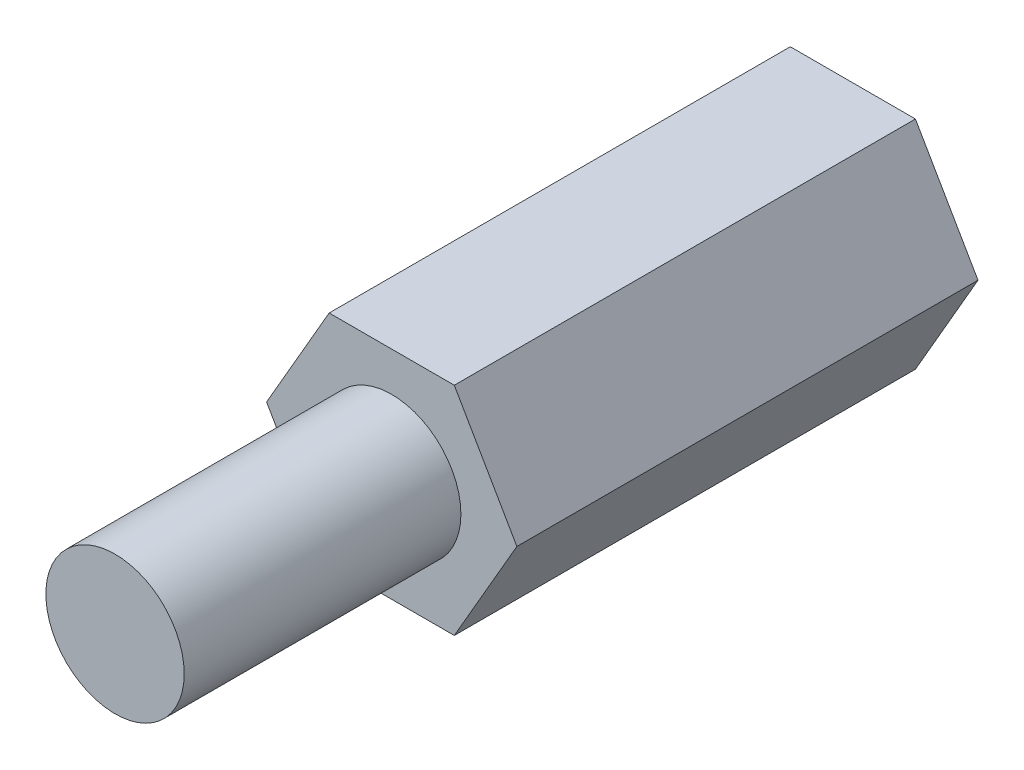
from build123d import *

# Parameters (mm, degrees)
EXTRUDE_1_DEPTH     = 10
SKETCH_2_R          = 1.5
EXTRUDE_2_DEPTH     = 6
SKETCH_3_R          = 1.5
CUT_EXTRUDE_1_DEPTH = 6


with BuildPart() as part:
    # 草图1 → 凸台-拉伸1 (new body)
    with BuildSketch(Plane.XY):
        Polygon((2.713546265, 0), (1.356773133, 2.35), (-1.356773133, 2.35), (-2.713546265, 0), (-1.356773133, -2.35), (1.356773133, -2.35), align=None)
    extrude(amount=EXTRUDE_1_DEPTH)

    # 草图2 → 凸台-拉伸2 (add)
    with BuildSketch(Plane.XY.offset(10)):
        Circle(SKETCH_2_R)
    extrude(amount=EXTRUDE_2_DEPTH)

    # 草图3 → 切除-拉伸1 (cut)
    with BuildSketch(Plane(origin=(0, 0, 0), x_dir=(-1, 0, 0), z_dir=(0, 0, -1))):
        with Locations(Location((0, 0, 0), (0, 0, 180))):
            Circle(SKETCH_3_R)
    extrude(amount=-CUT_EXTRUDE_1_DEPTH, mode=Mode.SUBTRACT)


solid = part.part
